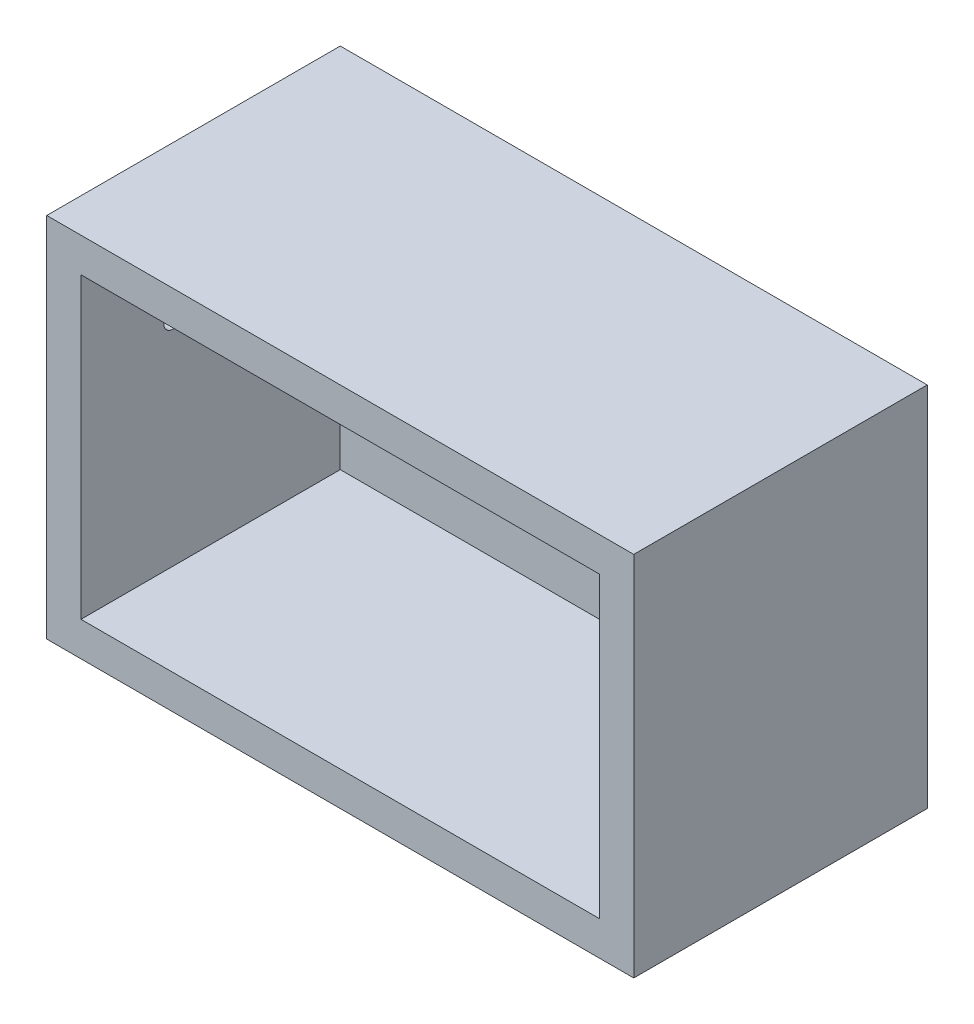
from build123d import *

# Parameters (mm, degrees)
SKICA1_W                 = 120
SKICA1_H                 = 75
P_IDAT_VYSUNUT_M9_DEPTH  = 7
SKICA9_W                 = 60
SKICA9_H                 = 75
P_IDAT_VYSUNUT_M10_DEPTH = 7
SKICA10_W                = 60
SKICA10_H                = 75
P_IDAT_VYSUNUT_M11_DEPTH = 7
SKICA11_W                = 120
SKICA11_H                = 60
P_IDAT_VYSUNUT_M12_DEPTH = 7
SKICA12_W                = 120
SKICA12_H                = 60
P_IDAT_VYSUNUT_M13_DEPTH = 7
SKICA13_R                = 1.75
SKICA13_W                = 7.3
SKICA13_H                = 8.5
ODEBRAT_VYSUNUT_M1_DEPTH = 7


with BuildPart() as part:
    # Skica1 → Přidat vysunutím9 (new body)
    with BuildSketch(Plane.XY):
        Rectangle(SKICA1_W, SKICA1_H)
    extrude(amount=P_IDAT_VYSUNUT_M9_DEPTH)

    # Skica9 → Přidat vysunutím10 (add)
    with BuildSketch(Plane.ZY.offset(60)):
        with Locations((30, 0)):
            Rectangle(SKICA9_W, SKICA9_H)
    extrude(amount=-P_IDAT_VYSUNUT_M10_DEPTH)

    # Skica10 → Přidat vysunutím11 (add)
    with BuildSketch(Plane(origin=(60, 0, 0), x_dir=(0, 0, -1), z_dir=(1, 0, 0))):
        with Locations((-30, 0)):
            Rectangle(SKICA10_W, SKICA10_H)
    extrude(amount=-P_IDAT_VYSUNUT_M11_DEPTH)

    # Skica11 → Přidat vysunutím12 (add)
    with BuildSketch(Plane(origin=(0, -37.5, 0), x_dir=(-1, 0, 0), z_dir=(0, -1, 0))):
        with Locations((0, -30)):
            Rectangle(SKICA11_W, SKICA11_H)
    extrude(amount=-P_IDAT_VYSUNUT_M12_DEPTH)

    # Skica12 → Přidat vysunutím13 (add)
    with BuildSketch(Plane(origin=(0, 37.5, 0), x_dir=(1, 0, 0), z_dir=(0, 1, 0))):
        with Locations((0, -30)):
            Rectangle(SKICA12_W, SKICA12_H)
    extrude(amount=-P_IDAT_VYSUNUT_M13_DEPTH)

    # Skica13 → Odebrat vysunutím1 (cut)
    with BuildSketch(Plane.ZY.offset(60)):
        with Locations(Location((41.3, 13.25, 0), (0, 0, 270))):
            Circle(SKICA13_R)
        with Locations((12.65, 13.25)):
            Rectangle(SKICA13_W, SKICA13_H)
    extrude(amount=-ODEBRAT_VYSUNUT_M1_DEPTH, mode=Mode.SUBTRACT)


solid = part.part
